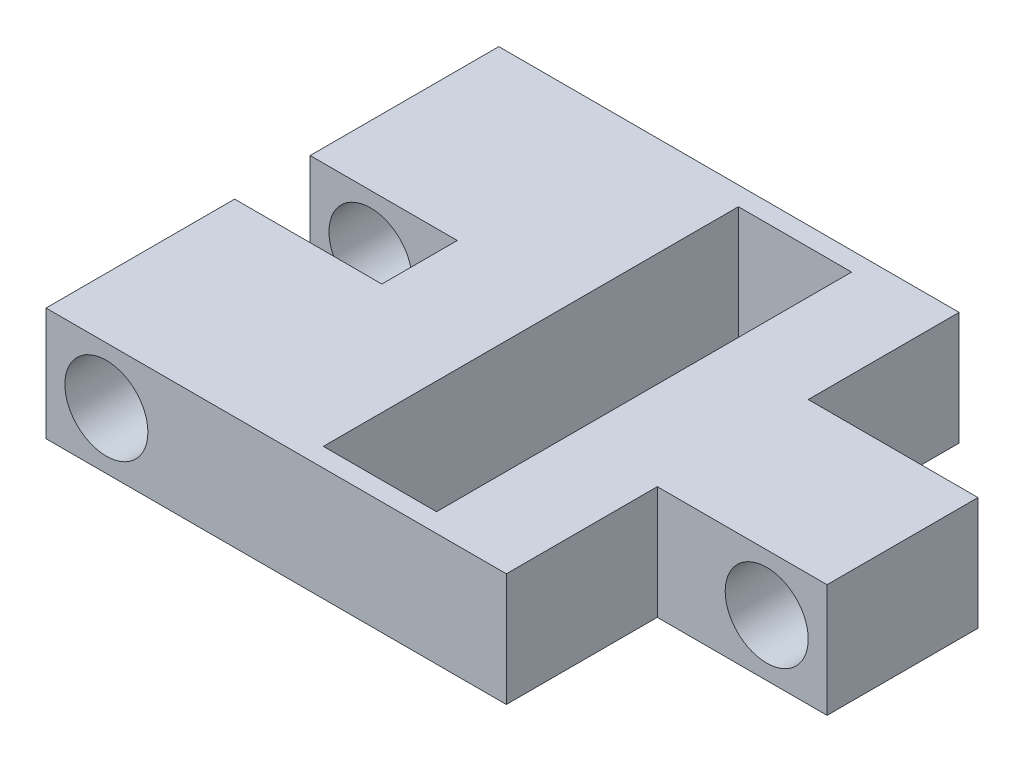
from build123d import *

# Parameters (mm, degrees)
BOSS_EXTRUDE1_DEPTH      = 6
BOSS_EXTRUDE1_DEPTH_BACK = 6
SKETCH1_W                = 16.7
SKETCH1_H                = 3
SKETCH1_R                = 1.1
SKETCH2_W                = 3
SKETCH2_H                = 11
SKETCH2_W_2              = 9
SKETCH2_H_2              = 8
SKETCH2_W_3              = 7.8
SKETCH2_H_3              = 2
CUT_EXTRUDE1_DEPTH       = 5


with BuildPart() as part:
    # Sketch1 → Boss-Extrude1 (new, two sides: drawn at the far end of the back side and taken through both)
    with BuildSketch(Plane.XY.offset(-BOSS_EXTRUDE1_DEPTH_BACK)):
        Rectangle(SKETCH1_W, SKETCH1_H)
        with Locations((-6.75, 0)):
            Circle(SKETCH1_R, mode=Mode.SUBTRACT)
        with Locations((6.75, 0)):
            Circle(SKETCH1_R, mode=Mode.SUBTRACT)
    extrude(amount=BOSS_EXTRUDE1_DEPTH + BOSS_EXTRUDE1_DEPTH_BACK)

    # Sketch2 → Cut-Extrude1 (cut)
    with BuildSketch(Plane(origin=(0, 1.5, 0), x_dir=(1, 0, 0), z_dir=(0, 1, 0))):
        Rectangle(SKETCH2_W, SKETCH2_H)
        with Locations((8.35, -6)):
            Rectangle(SKETCH2_W_2, SKETCH2_H_2)
        with Locations((8.35, 6)):
            Rectangle(SKETCH2_W_2, SKETCH2_H_2)
        with Locations((-8.35, 0)):
            Rectangle(SKETCH2_W_3, SKETCH2_H_3)
    extrude(amount=-CUT_EXTRUDE1_DEPTH, mode=Mode.SUBTRACT)


solid = part.part
